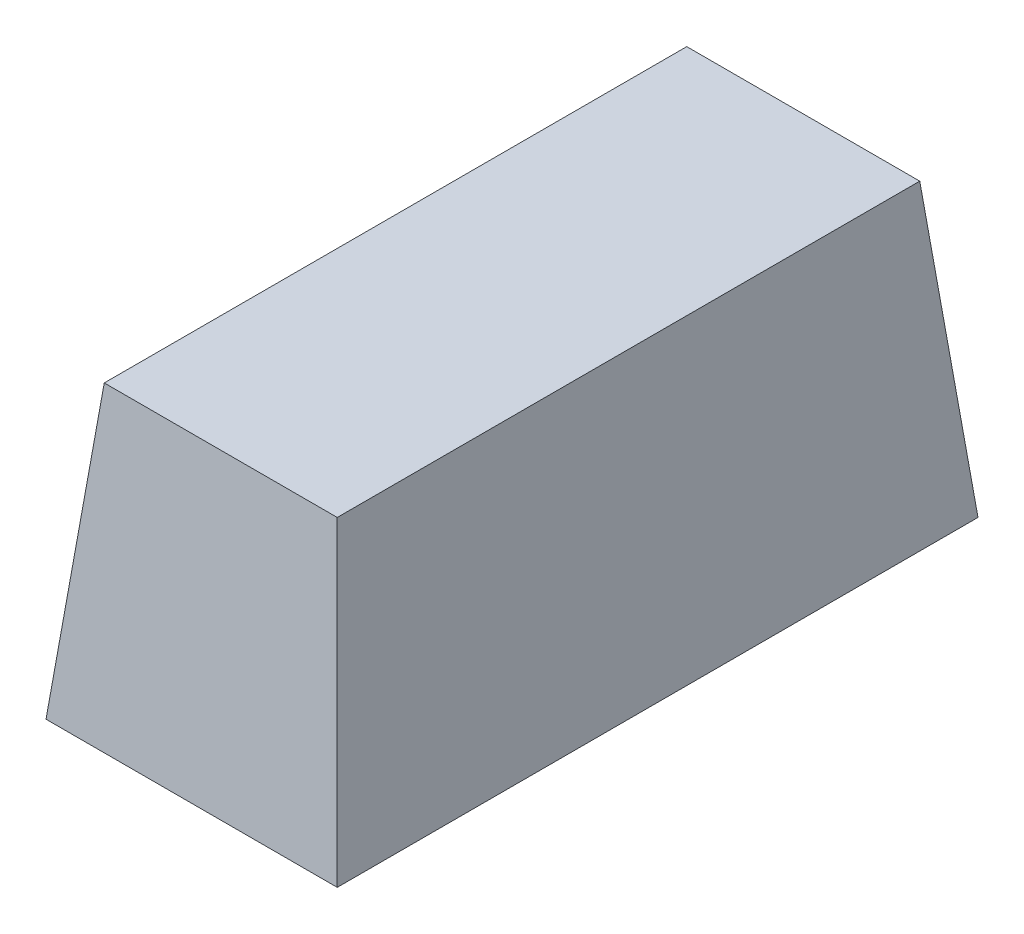
from build123d import *


with BuildPart() as part:
    # Sketch1 → Loft1 section 0
    with BuildSketch(Plane(origin=(0, 0, 0), x_dir=(1, 0, 0), z_dir=(0, 1, 0))):
        with BuildLine():
            Line((0, 0), (20, 0))
            Line((20, 0), (20, 44))
            Line((20, 44), (0, 44))
            Line((0, 44), (0, 0))
        make_face()
    # Sketch3 → Loft1 section 1
    with BuildSketch(Plane(origin=(0, 20, 0), x_dir=(1, 0, 0), z_dir=(0, 1, 0))):
        with BuildLine():
            Line((2, 42), (2, 2))
            Line((2, 2), (18, 2))
            Line((18, 2), (18, 42))
            Line((18, 42), (2, 42))
        make_face()
    loft()


solid = part.part
